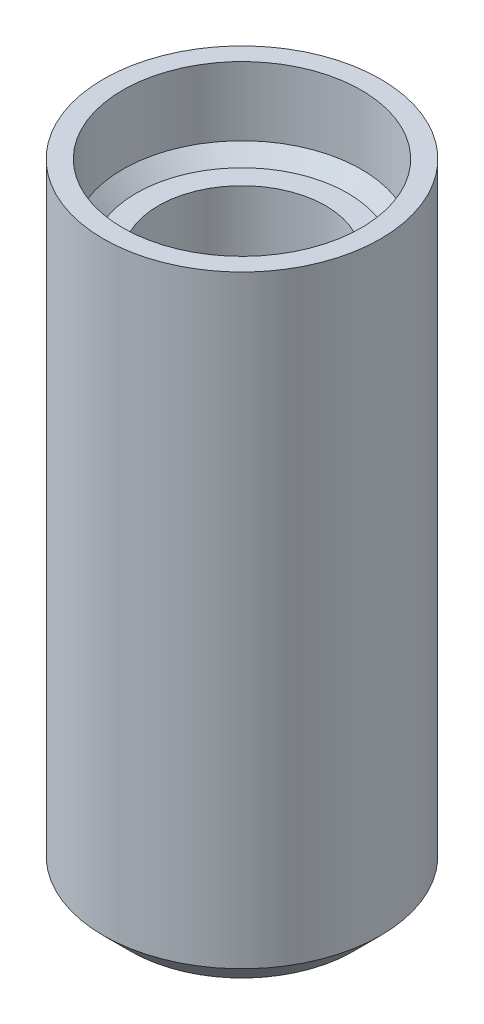
from build123d import *

# Parameters (mm, degrees)
SKETCH1_R           = 5.05
BOSS_EXTRUDE1_DEPTH = 20
SKETCH2_R           = 5.05
BOSS_EXTRUDE2_DEPTH = 2
SKETCH4_R           = 5.05
SKETCH4_R_2         = 4.35
BOSS_EXTRUDE3_DEPTH = 3
CHAMFER1_SIZE       = 1
CHAMFER2_SIZE       = 0.5
CUT_EXTRUDE1_DEPTH  = 0.4
BOSS_EXTRUDE4_DEPTH = 0.4


with BuildPart() as part:
    # Sketch1 → Boss-Extrude1 (new body)
    with BuildSketch(Plane(origin=(0, 0, 0), x_dir=(1, 0, 0), z_dir=(0, 1, 0))):
        Circle(SKETCH1_R)
        with BuildLine():
            Line((2.565151068, -1.65), (-2.565151068, -1.65))
            ThreePointArc((-2.565151068, -1.65), (0, 3.05), (2.565151068, -1.65))
        make_face(mode=Mode.SUBTRACT)
    extrude(amount=BOSS_EXTRUDE1_DEPTH)

    # Sketch2 → Boss-Extrude2 (add)
    with BuildSketch(Plane.XZ):
        Circle(SKETCH2_R)
    extrude(amount=-BOSS_EXTRUDE2_DEPTH)

    # Sketch4 → Boss-Extrude3 (add)
    with BuildSketch(Plane(origin=(0, 20, 0), x_dir=(1, 0, 0), z_dir=(0, 1, 0))):
        Circle(SKETCH4_R)
        Circle(SKETCH4_R_2, mode=Mode.SUBTRACT)
    extrude(amount=BOSS_EXTRUDE3_DEPTH)

    # Chamfer1
    chamfer1_edges = [part.edges().sort_by_distance(p)[0] for p in [
        (-5.05, 0, 0),
    ]]
    chamfer(chamfer1_edges, length=CHAMFER1_SIZE)

    # Chamfer2
    chamfer2_edges = [part.edges().sort_by_distance(p)[0] for p in [
        (-4.35, 20, 0),
    ]]
    chamfer(chamfer2_edges, length=CHAMFER2_SIZE)

    # Sketch5 → Cut-Extrude1 (cut)
    with BuildSketch(Plane.XZ):
        with BuildLine():
            add(Edge.make_bspline(
                [(1.503946302, -0.82704188), (1.503059518, -0.874793582), (1.501327168, -0.968077524), (1.480019469, -1.103919355), (1.449058312, -1.232322798), (1.403345003, -1.352211304), (1.34638964, -1.463796882), (1.276958459, -1.566936694), (1.194144312, -1.660167972), (1.099805246, -1.744828515), (0.992740374, -1.818541299), (0.874951179, -1.88448647), (0.744088214, -1.938781978), (0.602008652, -1.984699222), (0.448233222, -2.020972367), (0.282893585, -2.044705977), (0.106681456, -2.061730461), (-0.01462164, -2.063227776), (-0.076997251, -2.063997715)],
                knots=[0, 0, 0, 0, 1.005214737, 1.963707865, 2.890356951, 3.783890021, 4.660255313, 5.525147691, 6.395951212, 7.281332096, 8.189267761, 9.129287878, 10.120667592, 11.168998658, 12.272907703, 13.444977467, 14.686174592, 16, 16, 16, 16], degree=3))
            add(Edge.make_bspline(
                [(-0.076997251, -2.063997715), (-0.136681192, -2.062901639), (-0.252526897, -2.060774171), (-0.420939768, -2.048283333), (-0.577952339, -2.02535154), (-0.723457225, -1.993698532), (-0.857375327, -1.952794826), (-0.979740085, -1.902633341), (-1.091743598, -1.844842441), (-1.191989444, -1.777706274), (-1.281241428, -1.702460893), (-1.357486624, -1.617506712), (-1.423177211, -1.525187584), (-1.476393216, -1.424268136), (-1.517867508, -1.315150079), (-1.545840014, -1.198128824), (-1.564921756, -1.073651704), (-1.566916307, -0.988112528), (-1.567944017, -0.944037703)],
                knots=[0, 0, 0, 0, 1.352360865, 2.624913755, 3.823255849, 4.944666428, 5.995744585, 6.991482529, 7.937311172, 8.846364595, 9.719576528, 10.575071332, 11.425785957, 12.280513724, 13.152941511, 14.063280215, 15.002087828, 16, 16, 16, 16], degree=3))
            add(Edge.make_bspline(
                [(-1.567944017, -0.944037703), (-1.567574641, -0.913662982), (-1.566845482, -0.853702387), (-1.55483752, -0.765559589), (-1.538413899, -0.680125686), (-1.513956967, -0.597580096), (-1.483383556, -0.51772187), (-1.444682154, -0.441012754), (-1.399705152, -0.367234612), (-1.330356232, -0.270542607), (-1.224649255, -0.155839377), (-1.072661275, -0.030385914), (-0.896701543, 0.089237917), (-0.767318074, 0.159401834), (-0.699975007, 0.195921595)],
                knots=[0, 0, 0, 0, 0.720459814, 1.422208907, 2.108120419, 2.784193939, 3.463086274, 4.135445077, 4.820762983, 5.51249203, 6.957620505, 8.507729903, 10.182301167, 12, 12, 12, 12], degree=3))
            add(Edge.make_bspline(
                [(-0.699975007, 0.195921595), (-0.754428124, 0.227837432), (-0.86043486, 0.289969663), (-1.007954614, 0.393339409), (-1.135361355, 0.508166872), (-1.245787372, 0.630967326), (-1.331989476, 0.768184694), (-1.394846508, 0.91791339), (-1.432549456, 1.081389178), (-1.437437656, 1.194686315), (-1.439948587, 1.252883856)],
                knots=[0, 0, 0, 0, 1.111605955, 2.164021558, 3.165983824, 4.126996401, 5.063613954, 6.005699085, 6.975583916, 8, 8, 8, 8], degree=3))
            add(Edge.make_bspline(
                [(-1.439948587, 1.252883856), (-1.438746905, 1.295268748), (-1.436390356, 1.378387272), (-1.41932276, 1.500139718), (-1.390064164, 1.615638646), (-1.350209565, 1.725579657), (-1.297849939, 1.828742129), (-1.234844469, 1.925333993), (-1.159871247, 2.013831499), (-1.074531952, 2.095583861), (-0.976609751, 2.168633428), (-0.867606275, 2.233821178), (-0.746586959, 2.288576957), (-0.614723368, 2.334559345), (-0.471695663, 2.37174762), (-0.317358095, 2.396804838), (-0.152363765, 2.413555244), (-0.038710181, 2.415063316), (0.019999286, 2.415842333)],
                knots=[0, 0, 0, 0, 0.963864709, 1.890178498, 2.789289955, 3.669505997, 4.544220225, 5.414719257, 6.286372906, 7.176490452, 8.096828764, 9.058932879, 10.059657577, 11.112220212, 12.232007914, 13.416008536, 14.665200373, 16, 16, 16, 16], degree=3))
            add(Edge.make_bspline(
                [(0.019999286, 2.415842333), (0.077693327, 2.414865137), (0.188927536, 2.412981102), (0.349338611, 2.399136369), (0.496947726, 2.375764924), (0.631491294, 2.341311951), (0.754684451, 2.29979795), (0.865554107, 2.248539654), (0.966250118, 2.190746949), (1.053880678, 2.123093763), (1.132496615, 2.050008533), (1.198007939, 1.96806372), (1.255701778, 1.880892425), (1.298276542, 1.784921729), (1.334372619, 1.684964039), (1.357532961, 1.578692003), (1.373303199, 1.467684165), (1.375057805, 1.391603914), (1.375950872, 1.352880286)],
                knots=[0, 0, 0, 0, 1.414334715, 2.726839733, 3.944018885, 5.073757196, 6.128158228, 7.1264059, 8.064043944, 8.967883359, 9.834955856, 10.688795752, 11.534304537, 12.389863366, 13.255664127, 14.135846165, 15.051175604, 16, 16, 16, 16], degree=3))
            add(Edge.make_bspline(
                [(1.375950872, 1.352880286), (1.373499511, 1.300954714), (1.368590312, 1.196966394), (1.327091841, 1.045058675), (1.264879221, 0.898975005), (1.180042649, 0.760703153), (1.07410453, 0.629725986), (0.947042457, 0.507853569), (0.800426344, 0.393772504), (0.691738566, 0.329098456), (0.635977293, 0.295918025)],
                knots=[0, 0, 0, 0, 0.920117842, 1.842666447, 2.775531395, 3.731205609, 4.711408899, 5.757260842, 6.849383112, 8, 8, 8, 8], degree=3))
            add(Edge.make_bspline(
                [(0.635977293, 0.295918025), (0.701282864, 0.26033311), (0.827503303, 0.191555767), (1.000247577, 0.074173635), (1.150826677, -0.050356786), (1.276380114, -0.184934233), (1.376366982, -0.32943736), (1.437053487, -0.458746247), (1.472702756, -0.566196607), (1.490089039, -0.650462489), (1.501540522, -0.737732223), (1.503137202, -0.797005692), (1.503946302, -0.82704188)],
                knots=[0, 0, 0, 0, 1.488401617, 2.876733215, 4.174748825, 5.393220372, 6.550207752, 7.678741545, 8.240149572, 8.813490423, 9.39874912, 10, 10, 10, 10], degree=3))
        make_face()
        with BuildLine():
            add(Edge.make_bspline(
                [(0.543980577, 1.273883107), (0.542350846, 1.311060321), (0.539223195, 1.382407889), (0.512623797, 1.483429637), (0.469081441, 1.573172141), (0.402254118, 1.646423463), (0.318795874, 1.705947015), (0.21570504, 1.745831804), (0.095716886, 1.772873882), (0.009177463, 1.77482441), (-0.036998679, 1.775865183)],
                knots=[0, 0, 0, 0, 1.01803902, 1.953739888, 2.844979788, 3.725607907, 4.643773676, 5.63177738, 6.736351818, 8, 8, 8, 8], degree=3))
            add(Edge.make_bspline(
                [(-0.036998679, 1.775865183), (-0.082099345, 1.774492823), (-0.167031255, 1.771908445), (-0.285848586, 1.748733644), (-0.386121982, 1.707414033), (-0.468911697, 1.650728818), (-0.531582304, 1.578114875), (-0.577326093, 1.493332664), (-0.602989654, 1.395676683), (-0.606273502, 1.326694288), (-0.607978292, 1.2908825)],
                knots=[0, 0, 0, 0, 1.268768947, 2.389298845, 3.385938912, 4.302097553, 5.18643146, 6.059496316, 6.992599378, 8, 8, 8, 8], degree=3))
            add(Edge.make_bspline(
                [(-0.607978292, 1.2908825), (-0.606344413, 1.256365045), (-0.603149824, 1.188875894), (-0.575024529, 1.091406179), (-0.527541233, 1.001170946), (-0.459559578, 0.916938192), (-0.370102985, 0.837605659), (-0.259706131, 0.75985913), (-0.126828491, 0.681255403), (-0.030514423, 0.628906172), (0.02099925, 0.600907135)],
                knots=[0, 0, 0, 0, 0.837252004, 1.637010235, 2.441102344, 3.299813436, 4.251434797, 5.336812646, 6.575591634, 8, 8, 8, 8], degree=3))
            add(Edge.make_bspline(
                [(0.02099925, 0.600907135), (0.060757435, 0.624588205), (0.137424145, 0.670253009), (0.241344645, 0.746744727), (0.332481456, 0.824239486), (0.407917358, 0.905764085), (0.470153456, 0.989752872), (0.512101531, 1.080719503), (0.54000544, 1.175565654), (0.542651944, 1.24102189), (0.543980577, 1.273883107)],
                knots=[0, 0, 0, 0, 1.240896861, 2.392852753, 3.457941612, 4.44516871, 5.368342757, 6.248451414, 7.120664105, 8, 8, 8, 8], degree=3))
        make_face(mode=Mode.SUBTRACT)
        with BuildLine():
            add(Edge.make_bspline(
                [(0.607978292, -0.89203956), (0.606343598, -0.852123167), (0.603170829, -0.774649681), (0.569969583, -0.663867599), (0.518523109, -0.56050274), (0.440156084, -0.467435843), (0.342872023, -0.377231481), (0.22207371, -0.292855952), (0.082635514, -0.205873757), (-0.019901901, -0.152974761), (-0.073997358, -0.125066944)],
                knots=[0, 0, 0, 0, 0.878711838, 1.705486542, 2.531475027, 3.41058728, 4.373836987, 5.454189901, 6.656912115, 8, 8, 8, 8], degree=3))
            add(Edge.make_bspline(
                [(-0.073997358, -0.125066944), (-0.12101184, -0.152496493), (-0.210679606, -0.204811148), (-0.333529609, -0.288561166), (-0.438448797, -0.374869156), (-0.524349948, -0.465664799), (-0.591026495, -0.561970625), (-0.6378852, -0.664108488), (-0.667346061, -0.77273206), (-0.670415627, -0.847852917), (-0.671976007, -0.886039774)],
                knots=[0, 0, 0, 0, 1.280230351, 2.441702876, 3.493875971, 4.470304633, 5.372911365, 6.23602954, 7.103305118, 8, 8, 8, 8], degree=3))
            add(Edge.make_bspline(
                [(-0.671976007, -0.886039774), (-0.670357272, -0.927257619), (-0.667264677, -1.006004318), (-0.635642613, -1.11641195), (-0.583536927, -1.211319943), (-0.510700354, -1.29077302), (-0.415917072, -1.350953696), (-0.302007127, -1.393961567), (-0.168435673, -1.419436295), (-0.072782444, -1.42243077), (-0.021999215, -1.424020565)],
                knots=[0, 0, 0, 0, 1.026914924, 1.96192107, 2.837256448, 3.708826073, 4.62282237, 5.613389009, 6.732924999, 8, 8, 8, 8], degree=3))
            add(Edge.make_bspline(
                [(-0.021999215, -1.424020565), (0.027465775, -1.422452239), (0.120504441, -1.419502376), (0.250744315, -1.393711621), (0.362220195, -1.350691196), (0.452872039, -1.2868733), (0.523180459, -1.207559708), (0.573194484, -1.114080851), (0.602750359, -1.007129715), (0.606182808, -0.931566193), (0.607978292, -0.89203956)],
                knots=[0, 0, 0, 0, 1.26464001, 2.378660545, 3.38122098, 4.299358904, 5.187574635, 6.069090169, 6.989957532, 8, 8, 8, 8], degree=3))
        make_face(mode=Mode.SUBTRACT)
    extrude(amount=-CUT_EXTRUDE1_DEPTH, mode=Mode.SUBTRACT)


with BuildPart() as body_2:
    # Sketch5<2> → Boss-Extrude4 (new body)
    with BuildSketch(Plane.XZ):
        with BuildLine():
            add(Edge.make_bspline(
                [(1.503946302, -0.82704188), (1.503059518, -0.874793582), (1.501327168, -0.968077524), (1.480019469, -1.103919355), (1.449058312, -1.232322798), (1.403345003, -1.352211304), (1.34638964, -1.463796882), (1.276958459, -1.566936694), (1.194144312, -1.660167972), (1.099805246, -1.744828515), (0.992740374, -1.818541299), (0.874951179, -1.88448647), (0.744088214, -1.938781978), (0.602008652, -1.984699222), (0.448233222, -2.020972367), (0.282893585, -2.044705977), (0.106681456, -2.061730461), (-0.01462164, -2.063227776), (-0.076997251, -2.063997715)],
                knots=[0, 0, 0, 0, 1.005214737, 1.963707865, 2.890356951, 3.783890021, 4.660255313, 5.525147691, 6.395951212, 7.281332096, 8.189267761, 9.129287878, 10.120667592, 11.168998658, 12.272907703, 13.444977467, 14.686174592, 16, 16, 16, 16], degree=3))
            add(Edge.make_bspline(
                [(-0.076997251, -2.063997715), (-0.136681192, -2.062901639), (-0.252526897, -2.060774171), (-0.420939768, -2.048283333), (-0.577952339, -2.02535154), (-0.723457225, -1.993698532), (-0.857375327, -1.952794826), (-0.979740085, -1.902633341), (-1.091743598, -1.844842441), (-1.191989444, -1.777706274), (-1.281241428, -1.702460893), (-1.357486624, -1.617506712), (-1.423177211, -1.525187584), (-1.476393216, -1.424268136), (-1.517867508, -1.315150079), (-1.545840014, -1.198128824), (-1.564921756, -1.073651704), (-1.566916307, -0.988112528), (-1.567944017, -0.944037703)],
                knots=[0, 0, 0, 0, 1.352360865, 2.624913755, 3.823255849, 4.944666428, 5.995744585, 6.991482529, 7.937311172, 8.846364595, 9.719576528, 10.575071332, 11.425785957, 12.280513724, 13.152941511, 14.063280215, 15.002087828, 16, 16, 16, 16], degree=3))
            add(Edge.make_bspline(
                [(-1.567944017, -0.944037703), (-1.567574641, -0.913662982), (-1.566845482, -0.853702387), (-1.55483752, -0.765559589), (-1.538413899, -0.680125686), (-1.513956967, -0.597580096), (-1.483383556, -0.51772187), (-1.444682154, -0.441012754), (-1.399705152, -0.367234612), (-1.330356232, -0.270542607), (-1.224649255, -0.155839377), (-1.072661275, -0.030385914), (-0.896701543, 0.089237917), (-0.767318074, 0.159401834), (-0.699975007, 0.195921595)],
                knots=[0, 0, 0, 0, 0.720459814, 1.422208907, 2.108120419, 2.784193939, 3.463086274, 4.135445077, 4.820762983, 5.51249203, 6.957620505, 8.507729903, 10.182301167, 12, 12, 12, 12], degree=3))
            add(Edge.make_bspline(
                [(-0.699975007, 0.195921595), (-0.754428124, 0.227837432), (-0.86043486, 0.289969663), (-1.007954614, 0.393339409), (-1.135361355, 0.508166872), (-1.245787372, 0.630967326), (-1.331989476, 0.768184694), (-1.394846508, 0.91791339), (-1.432549456, 1.081389178), (-1.437437656, 1.194686315), (-1.439948587, 1.252883856)],
                knots=[0, 0, 0, 0, 1.111605955, 2.164021558, 3.165983824, 4.126996401, 5.063613954, 6.005699085, 6.975583916, 8, 8, 8, 8], degree=3))
            add(Edge.make_bspline(
                [(-1.439948587, 1.252883856), (-1.438746905, 1.295268748), (-1.436390356, 1.378387272), (-1.41932276, 1.500139718), (-1.390064164, 1.615638646), (-1.350209565, 1.725579657), (-1.297849939, 1.828742129), (-1.234844469, 1.925333993), (-1.159871247, 2.013831499), (-1.074531952, 2.095583861), (-0.976609751, 2.168633428), (-0.867606275, 2.233821178), (-0.746586959, 2.288576957), (-0.614723368, 2.334559345), (-0.471695663, 2.37174762), (-0.317358095, 2.396804838), (-0.152363765, 2.413555244), (-0.038710181, 2.415063316), (0.019999286, 2.415842333)],
                knots=[0, 0, 0, 0, 0.963864709, 1.890178498, 2.789289955, 3.669505997, 4.544220225, 5.414719257, 6.286372906, 7.176490452, 8.096828764, 9.058932879, 10.059657577, 11.112220212, 12.232007914, 13.416008536, 14.665200373, 16, 16, 16, 16], degree=3))
            add(Edge.make_bspline(
                [(0.019999286, 2.415842333), (0.077693327, 2.414865137), (0.188927536, 2.412981102), (0.349338611, 2.399136369), (0.496947726, 2.375764924), (0.631491294, 2.341311951), (0.754684451, 2.29979795), (0.865554107, 2.248539654), (0.966250118, 2.190746949), (1.053880678, 2.123093763), (1.132496615, 2.050008533), (1.198007939, 1.96806372), (1.255701778, 1.880892425), (1.298276542, 1.784921729), (1.334372619, 1.684964039), (1.357532961, 1.578692003), (1.373303199, 1.467684165), (1.375057805, 1.391603914), (1.375950872, 1.352880286)],
                knots=[0, 0, 0, 0, 1.414334715, 2.726839733, 3.944018885, 5.073757196, 6.128158228, 7.1264059, 8.064043944, 8.967883359, 9.834955856, 10.688795752, 11.534304537, 12.389863366, 13.255664127, 14.135846165, 15.051175604, 16, 16, 16, 16], degree=3))
            add(Edge.make_bspline(
                [(1.375950872, 1.352880286), (1.373499511, 1.300954714), (1.368590312, 1.196966394), (1.327091841, 1.045058675), (1.264879221, 0.898975005), (1.180042649, 0.760703153), (1.07410453, 0.629725986), (0.947042457, 0.507853569), (0.800426344, 0.393772504), (0.691738566, 0.329098456), (0.635977293, 0.295918025)],
                knots=[0, 0, 0, 0, 0.920117842, 1.842666447, 2.775531395, 3.731205609, 4.711408899, 5.757260842, 6.849383112, 8, 8, 8, 8], degree=3))
            add(Edge.make_bspline(
                [(0.635977293, 0.295918025), (0.701282864, 0.26033311), (0.827503303, 0.191555767), (1.000247577, 0.074173635), (1.150826677, -0.050356786), (1.276380114, -0.184934233), (1.376366982, -0.32943736), (1.437053487, -0.458746247), (1.472702756, -0.566196607), (1.490089039, -0.650462489), (1.501540522, -0.737732223), (1.503137202, -0.797005692), (1.503946302, -0.82704188)],
                knots=[0, 0, 0, 0, 1.488401617, 2.876733215, 4.174748825, 5.393220372, 6.550207752, 7.678741545, 8.240149572, 8.813490423, 9.39874912, 10, 10, 10, 10], degree=3))
        make_face()
        with BuildLine():
            add(Edge.make_bspline(
                [(0.543980577, 1.273883107), (0.542350846, 1.311060321), (0.539223195, 1.382407889), (0.512623797, 1.483429637), (0.469081441, 1.573172141), (0.402254118, 1.646423463), (0.318795874, 1.705947015), (0.21570504, 1.745831804), (0.095716886, 1.772873882), (0.009177463, 1.77482441), (-0.036998679, 1.775865183)],
                knots=[0, 0, 0, 0, 1.01803902, 1.953739888, 2.844979788, 3.725607907, 4.643773676, 5.63177738, 6.736351818, 8, 8, 8, 8], degree=3))
            add(Edge.make_bspline(
                [(-0.036998679, 1.775865183), (-0.082099345, 1.774492823), (-0.167031255, 1.771908445), (-0.285848586, 1.748733644), (-0.386121982, 1.707414033), (-0.468911697, 1.650728818), (-0.531582304, 1.578114875), (-0.577326093, 1.493332664), (-0.602989654, 1.395676683), (-0.606273502, 1.326694288), (-0.607978292, 1.2908825)],
                knots=[0, 0, 0, 0, 1.268768947, 2.389298845, 3.385938912, 4.302097553, 5.18643146, 6.059496316, 6.992599378, 8, 8, 8, 8], degree=3))
            add(Edge.make_bspline(
                [(-0.607978292, 1.2908825), (-0.606344413, 1.256365045), (-0.603149824, 1.188875894), (-0.575024529, 1.091406179), (-0.527541233, 1.001170946), (-0.459559578, 0.916938192), (-0.370102985, 0.837605659), (-0.259706131, 0.75985913), (-0.126828491, 0.681255403), (-0.030514423, 0.628906172), (0.02099925, 0.600907135)],
                knots=[0, 0, 0, 0, 0.837252004, 1.637010235, 2.441102344, 3.299813436, 4.251434797, 5.336812646, 6.575591634, 8, 8, 8, 8], degree=3))
            add(Edge.make_bspline(
                [(0.02099925, 0.600907135), (0.060757435, 0.624588205), (0.137424145, 0.670253009), (0.241344645, 0.746744727), (0.332481456, 0.824239486), (0.407917358, 0.905764085), (0.470153456, 0.989752872), (0.512101531, 1.080719503), (0.54000544, 1.175565654), (0.542651944, 1.24102189), (0.543980577, 1.273883107)],
                knots=[0, 0, 0, 0, 1.240896861, 2.392852753, 3.457941612, 4.44516871, 5.368342757, 6.248451414, 7.120664105, 8, 8, 8, 8], degree=3))
        make_face(mode=Mode.SUBTRACT)
        with BuildLine():
            add(Edge.make_bspline(
                [(0.607978292, -0.89203956), (0.606343598, -0.852123167), (0.603170829, -0.774649681), (0.569969583, -0.663867599), (0.518523109, -0.56050274), (0.440156084, -0.467435843), (0.342872023, -0.377231481), (0.22207371, -0.292855952), (0.082635514, -0.205873757), (-0.019901901, -0.152974761), (-0.073997358, -0.125066944)],
                knots=[0, 0, 0, 0, 0.878711838, 1.705486542, 2.531475027, 3.41058728, 4.373836987, 5.454189901, 6.656912115, 8, 8, 8, 8], degree=3))
            add(Edge.make_bspline(
                [(-0.073997358, -0.125066944), (-0.12101184, -0.152496493), (-0.210679606, -0.204811148), (-0.333529609, -0.288561166), (-0.438448797, -0.374869156), (-0.524349948, -0.465664799), (-0.591026495, -0.561970625), (-0.6378852, -0.664108488), (-0.667346061, -0.77273206), (-0.670415627, -0.847852917), (-0.671976007, -0.886039774)],
                knots=[0, 0, 0, 0, 1.280230351, 2.441702876, 3.493875971, 4.470304633, 5.372911365, 6.23602954, 7.103305118, 8, 8, 8, 8], degree=3))
            add(Edge.make_bspline(
                [(-0.671976007, -0.886039774), (-0.670357272, -0.927257619), (-0.667264677, -1.006004318), (-0.635642613, -1.11641195), (-0.583536927, -1.211319943), (-0.510700354, -1.29077302), (-0.415917072, -1.350953696), (-0.302007127, -1.393961567), (-0.168435673, -1.419436295), (-0.072782444, -1.42243077), (-0.021999215, -1.424020565)],
                knots=[0, 0, 0, 0, 1.026914924, 1.96192107, 2.837256448, 3.708826073, 4.62282237, 5.613389009, 6.732924999, 8, 8, 8, 8], degree=3))
            add(Edge.make_bspline(
                [(-0.021999215, -1.424020565), (0.027465775, -1.422452239), (0.120504441, -1.419502376), (0.250744315, -1.393711621), (0.362220195, -1.350691196), (0.452872039, -1.2868733), (0.523180459, -1.207559708), (0.573194484, -1.114080851), (0.602750359, -1.007129715), (0.606182808, -0.931566193), (0.607978292, -0.89203956)],
                knots=[0, 0, 0, 0, 1.26464001, 2.378660545, 3.38122098, 4.299358904, 5.187574635, 6.069090169, 6.989957532, 8, 8, 8, 8], degree=3))
        make_face(mode=Mode.SUBTRACT)
    extrude(amount=-BOSS_EXTRUDE4_DEPTH)


solid = Compound([part.part, body_2.part])
